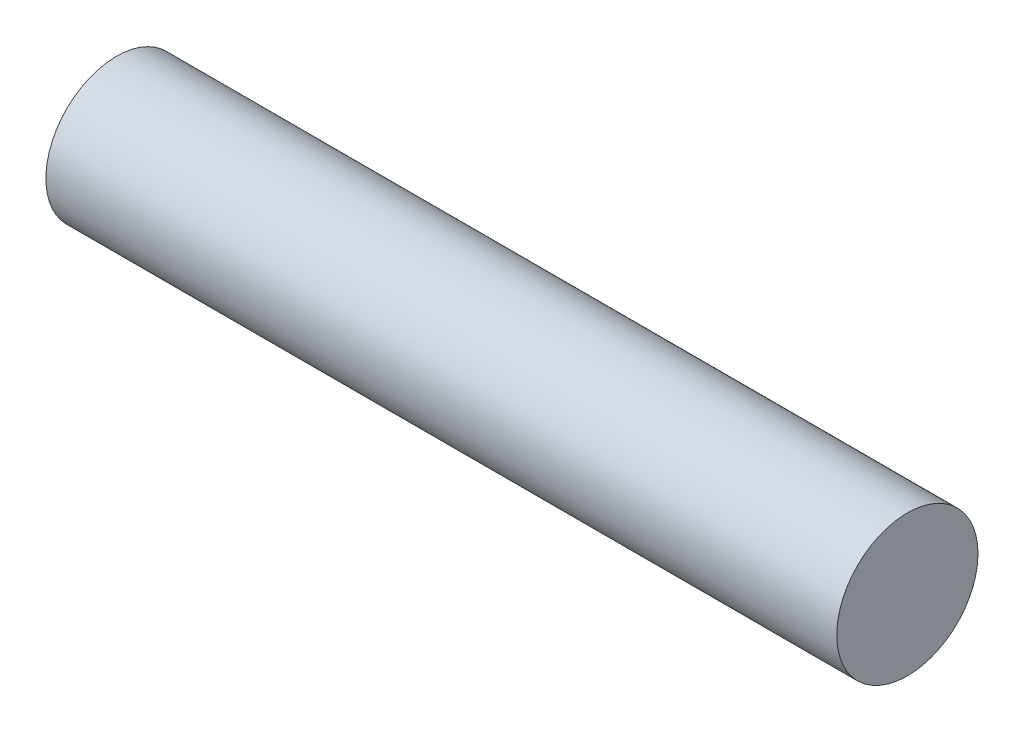
from build123d import *

# Parameters (mm, degrees)
SKETCH1_R           = 2.5
BOSS_EXTRUDE1_DEPTH = 28


with BuildPart() as part:
    # Sketch1 → Boss-Extrude1 (new body)
    with BuildSketch(Plane(origin=(0, 0, 0), x_dir=(0, 0, -1), z_dir=(1, 0, 0))):
        Circle(SKETCH1_R)
    extrude(amount=BOSS_EXTRUDE1_DEPTH)


solid = part.part
